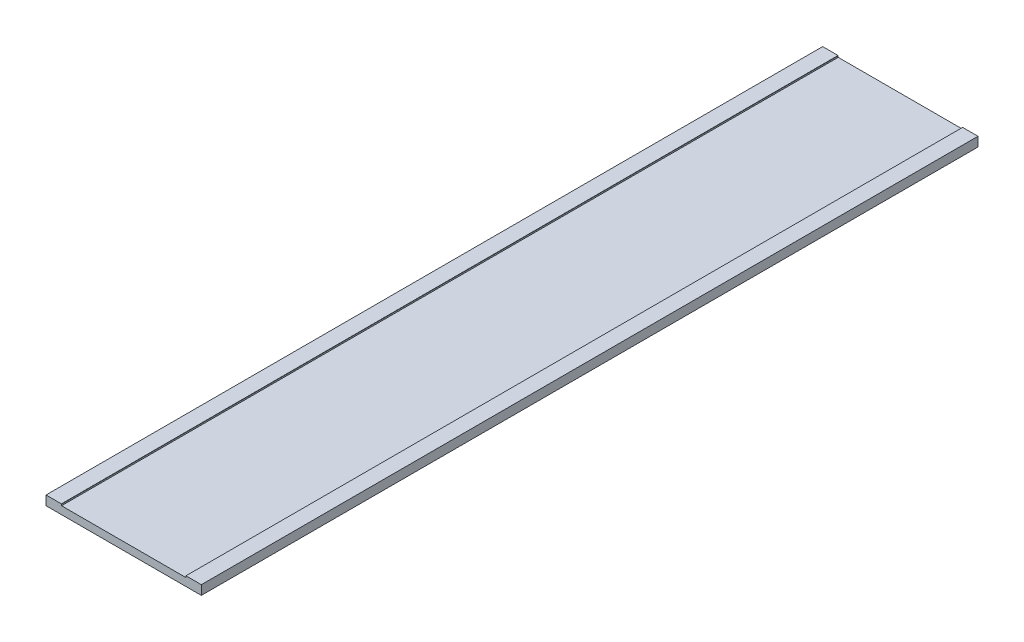
from build123d import *

# Parameters (mm, degrees)
BOSS_EXTRU_1_DEPTH = 100000
CHANFREIN1_SIZE    = 20
CHANFREIN2_SIZE    = 20


with BuildPart() as part:
    # Esquisse1 → Boss.-Extru.1 (new body)
    with BuildSketch(Plane.XY):
        Polygon((-10098.145385544, 0), (-10098.145385544, 1200), (-8098.145385544, 1200), (-8098.145385544, 1000), (0, 1000), (7901.854614456, 1000), (7901.854614456, 1200), (9901.854614456, 1200), (9901.854614456, 0), align=None)
    extrude(amount=BOSS_EXTRU_1_DEPTH)

    # Chanfrein1
    chanfrein1_edges = [part.edges().sort_by_distance(p)[0] for p in [
        (-8098.145385544, 1200, 50000),
    ]]
    chamfer(chanfrein1_edges, length=CHANFREIN1_SIZE)

    # Chanfrein2
    chanfrein2_edges = [part.edges().sort_by_distance(p)[0] for p in [
        (7901.854614456, 1200, 50000),
    ]]
    chamfer(chanfrein2_edges, length=CHANFREIN2_SIZE)


solid = part.part
